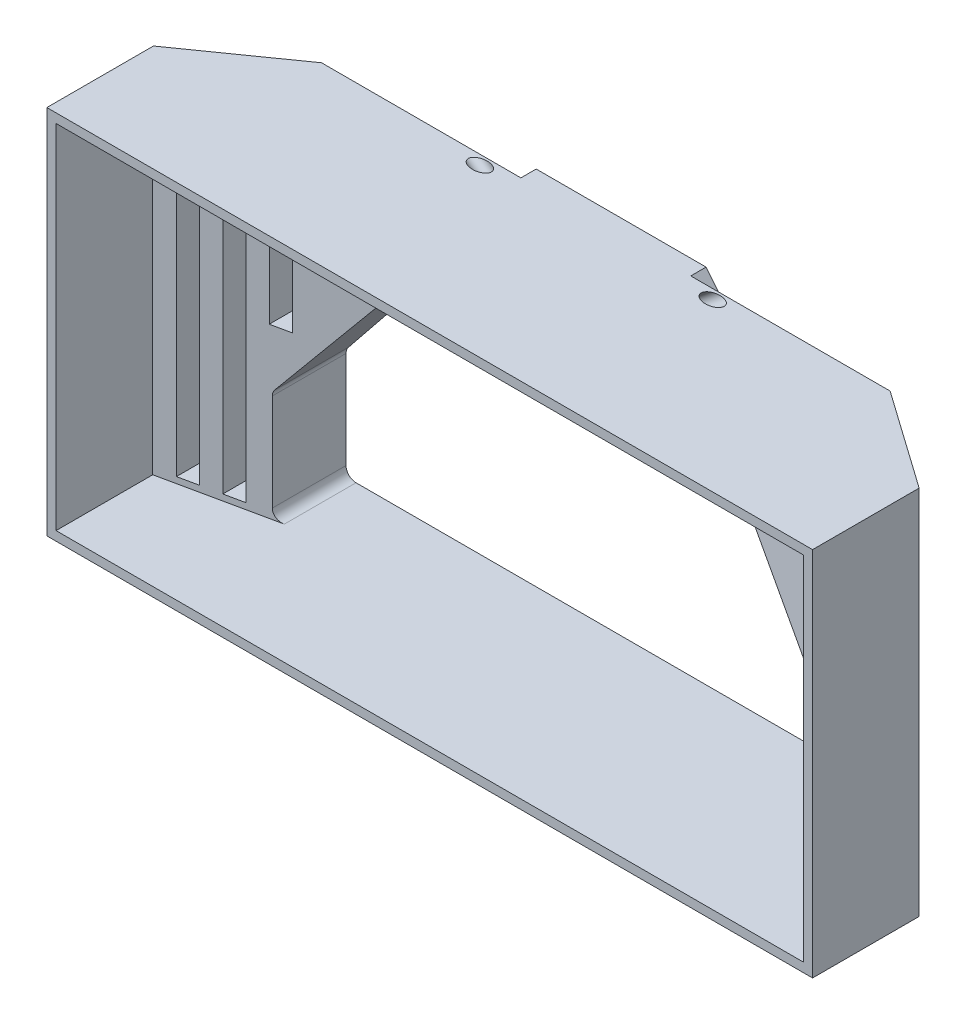
from build123d import *

# Parameters (mm, degrees)
EXTRUDE_1_DEPTH      = 50
EXTRUDE_START        = -4
EXTRUDE_2_DEPTH      = 46
CUT_EXTRUDE_1_DEPTH  = 92.1
CUT_EXTRUDE_START    = 94.5
CUT_EXTRUDE_2_DEPTH  = 241.890744243
SKETCH_17_W          = 5
SKETCH_17_H          = 88.9
SKETCH_17_H_2        = 46.554557274
SKETCH_17_H_3        = 30
SKETCH_17_H_4        = 15
SKETCH_17_H_5        = 12
CUT_EXTRUDE_5_DEPTH  = 30
SKETCH_37_R          = 1.9
CUT_EXTRUDE_13_DEPTH = 174.81246936


with BuildPart() as part:
    # 草图1 → 凸台-拉伸1 (new body)
    with BuildSketch(Plane.XY):
        with BuildLine():
            Line((-22.183039724, 96.9), (-73.14723658, 33.490663373))
            ThreePointArc((-73.14723658, 33.490663373), (-73.966258204, 32.018718559), (-74.25, 30.358324465))
            Line((-74.25, 30.358324465), (-74.25, 5))
            ThreePointArc((-74.25, 5), (-72.785533906, 1.464466094), (-69.25, 0))
            Line((-69.25, 0), (69.25, 0))
            ThreePointArc((69.25, 0), (72.785533906, 1.464466094), (74.25, 5))
            Line((74.25, 5), (74.25, 30.358324465))
            ThreePointArc((74.25, 30.358324465), (73.966258204, 32.018718559), (73.14723658, 33.490663373))
            Line((73.14723658, 33.490663373), (22.183039724, 96.9))
            Line((22.183039724, 96.9), (-22.183039724, 96.9))
        make_face()
        with BuildLine():
            ThreePointArc((-69.25, 2.4), (-71.088477631, 3.161522369), (-71.85, 5))
            Line((-71.85, 5), (-71.85, 30.358324465))
            ThreePointArc((-71.85, 30.358324465), (-71.702454266, 31.221729394), (-71.276563022, 31.987140697))
            Line((-71.276563022, 31.987140697), (-21.032894864, 94.5))
            Line((-21.032894864, 94.5), (21.032894864, 94.5))
            Line((21.032894864, 94.5), (71.276563022, 31.987140697))
            ThreePointArc((71.276563022, 31.987140697), (71.702454266, 31.221729394), (71.85, 30.358324465))
            Line((71.85, 30.358324465), (71.85, 5))
            ThreePointArc((71.85, 5), (71.088477631, 3.161522369), (69.25, 2.4))
            Line((69.25, 2.4), (-69.25, 2.4))
        make_face(mode=Mode.SUBTRACT)
    extrude(amount=EXTRUDE_1_DEPTH)

    # 草图2 → Extrude 2 (add)
    with BuildSketch(Plane(origin=(0, 0, 0), x_dir=(-1, 0, 0), z_dir=(0, 0, -1)).offset(EXTRUDE_START)):
        with BuildLine():
            Line((-100, 96.9), (-100, 0))
            Line((-100, 0), (-69.25, 0))
            ThreePointArc((-69.25, 0), (-72.785533906, 1.464466094), (-74.25, 5))
            Line((-74.25, 5), (-74.25, 30.358324465))
            ThreePointArc((-74.25, 30.358324465), (-73.966258204, 32.018718559), (-73.14723658, 33.490663373))
            Line((-73.14723658, 33.490663373), (-22.183039724, 96.9))
            Line((-22.183039724, 96.9), (-100, 96.9))
        make_face()
    extrude_2 = extrude(amount=-EXTRUDE_2_DEPTH)

    # 草图4 → Cut-Extrude 1 (cut)
    with BuildSketch(Plane.XZ.offset(-94.5)):
        Polygon((21.032894864, 50), (21.032894864, 8.470679814), (97.6, 24.745520419), (97.6, 50), align=None)
    cut_extrude_1 = extrude(amount=CUT_EXTRUDE_1_DEPTH, mode=Mode.SUBTRACT)

    # 草图4<4> → 切除-拉伸2 (cut, through all)
    with BuildSketch(Plane.XZ.offset(-94.5).offset(CUT_EXTRUDE_START)):
        Polygon((97.6, 4), (97.6, 20.470256304), (74.25, 4), align=None)
        Polygon((100, 22.163130613), (97.6, 20.470256304), (97.6, 4), (100, 4), align=None)
    cut_extrude_2 = extrude(amount=-CUT_EXTRUDE_2_DEPTH, mode=Mode.SUBTRACT)

    # 镜向1: Extrude 2, Cut-Extrude 1, 切除-拉伸2 across plane
    add(extrude_2.mirror(Plane(origin=(0, 0, 0), x_dir=(0, 0, 1), z_dir=(1, 0, 0))))
    add(cut_extrude_1.mirror(Plane(origin=(0, 0, 0), x_dir=(0, 0, 1), z_dir=(1, 0, 0))), mode=Mode.SUBTRACT)
    add(cut_extrude_2.mirror(Plane(origin=(0, 0, 0), x_dir=(0, 0, 1), z_dir=(1, 0, 0))), mode=Mode.SUBTRACT)

    # 草图17 → Cut-Extrude 5 (cut)
    with BuildSketch(Plane(origin=(0, 0, 4), x_dir=(-1, 0, 0), z_dir=(0, 0, -1))):
        with Locations((-90, 48.45)):
            Rectangle(SKETCH_17_W, SKETCH_17_H)
        with Locations((-80, 48.45)):
            Rectangle(SKETCH_17_W, SKETCH_17_H)
        with Locations((-70, 69.622721363)):
            Rectangle(SKETCH_17_W, SKETCH_17_H_2)
        with Locations((-60, 77.9)):
            Rectangle(SKETCH_17_W, SKETCH_17_H_3)
        with Locations((-50, 85.4)):
            Rectangle(SKETCH_17_W, SKETCH_17_H_4)
        with Locations((-40, 86.9)):
            Rectangle(SKETCH_17_W, SKETCH_17_H_5)
    cut_extrude_5 = extrude(amount=-CUT_EXTRUDE_5_DEPTH, mode=Mode.SUBTRACT)

    # 镜向2: Cut-Extrude 5 across plane
    add(cut_extrude_5.mirror(Plane(origin=(0, 0, 0), x_dir=(0, 0, 1), z_dir=(1, 0, 0))), mode=Mode.SUBTRACT)

    # 草图37 → 切除-拉伸13 (cut, through all)
    with BuildSketch(Plane(origin=(-58.922506005, 47.35798157, 0), x_dir=(0, 0, -1), z_dir=(0.7794473160570582, -0.6264677816866949, 0))):
        with Locations(Location((-6.5, 56.48134038, 0), (0, 0, 90))):
            Circle(SKETCH_37_R)
    cut_extrude_13 = extrude(amount=-CUT_EXTRUDE_13_DEPTH, mode=Mode.SUBTRACT)

    # 镜向4: 切除-拉伸13 across plane
    add(cut_extrude_13.mirror(Plane(origin=(0, 0, 0), x_dir=(0, 0, 1), z_dir=(1, 0, 0))), mode=Mode.SUBTRACT)


solid = part.part
